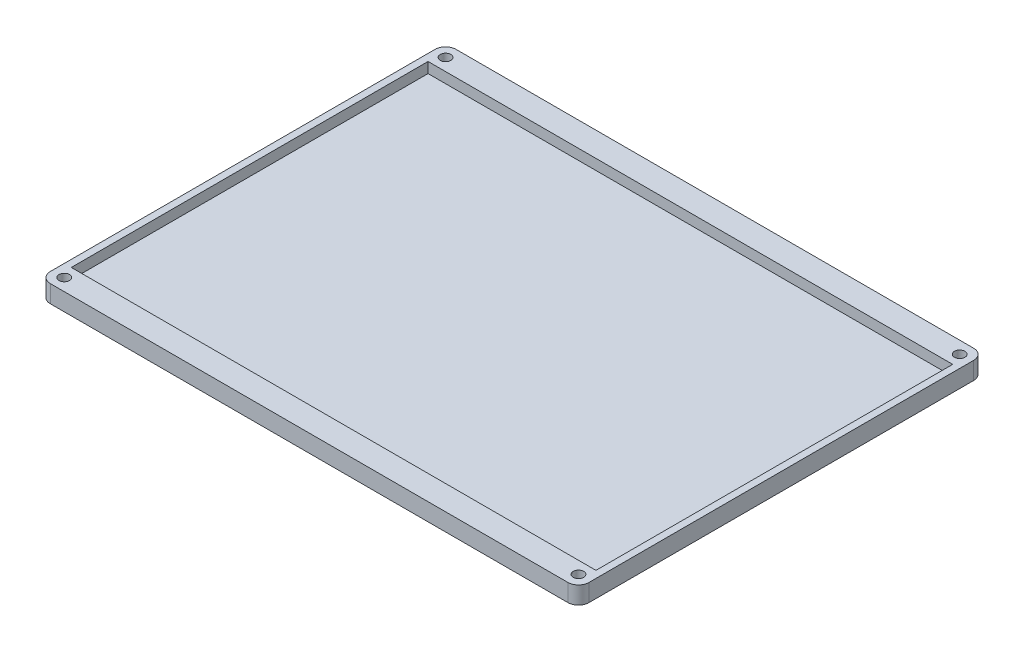
from build123d import *

# Parameters (mm, degrees)
SKETCH1_W           = 154
SKETCH1_H           = 116
BOSS_EXTRUDE1_DEPTH = 5
SKETCH2_W           = 150
SKETCH2_H           = 102
CUT_EXTRUDE1_DEPTH  = 3
SKETCH3_R           = 1.5
CUT_EXTRUDE2_DEPTH  = 97.529788149
FILLET1_R           = 3
FILLET2_R           = 3
FILLET3_R           = 3
FILLET4_R           = 3


with BuildPart() as part:
    # Sketch1 → Boss-Extrude1 (new body)
    with BuildSketch(Plane(origin=(0, 0, 0), x_dir=(1, 0, 0), z_dir=(0, 1, 0))):
        Rectangle(SKETCH1_W, SKETCH1_H)
    extrude(amount=BOSS_EXTRUDE1_DEPTH)

    # Sketch2 → Cut-Extrude1 (cut)
    with BuildSketch(Plane(origin=(0, 5, 0), x_dir=(1, 0, 0), z_dir=(0, 1, 0))):
        Rectangle(SKETCH2_W, SKETCH2_H)
    extrude(amount=-CUT_EXTRUDE1_DEPTH, mode=Mode.SUBTRACT)

    # Sketch3 → Cut-Extrude2 (cut, through all)
    with BuildSketch(Plane(origin=(0, 5, 0), x_dir=(1, 0, 0), z_dir=(0, 1, 0))):
        with Locations(Location((-73.5, 54.5, 0), (0, 0, 270))):
            Circle(SKETCH3_R)
        with Locations(Location((73.5, 54.5, 0), (0, 0, 270))):
            Circle(SKETCH3_R)
        with Locations(Location((73.5, -54.5, 0), (0, 0, 270))):
            Circle(SKETCH3_R)
        with Locations(Location((-73.5, -54.5, 0), (0, 0, 270))):
            Circle(SKETCH3_R)
    extrude(amount=-CUT_EXTRUDE2_DEPTH, mode=Mode.SUBTRACT)

    # Fillet1
    fillet1_edges = [part.edges().sort_by_distance(p)[0] for p in [
        (77, 2.5, 58),
    ]]
    fillet(fillet1_edges, radius=FILLET1_R)

    # Fillet2
    fillet2_edges = [part.edges().sort_by_distance(p)[0] for p in [
        (-77, 2.5, 58),
    ]]
    fillet(fillet2_edges, radius=FILLET2_R)

    # Fillet3
    fillet3_edges = [part.edges().sort_by_distance(p)[0] for p in [
        (-77, 2.5, -58),
    ]]
    fillet(fillet3_edges, radius=FILLET3_R)

    # Fillet4
    fillet4_edges = [part.edges().sort_by_distance(p)[0] for p in [
        (77, 2.5, -58),
    ]]
    fillet(fillet4_edges, radius=FILLET4_R)


solid = part.part
